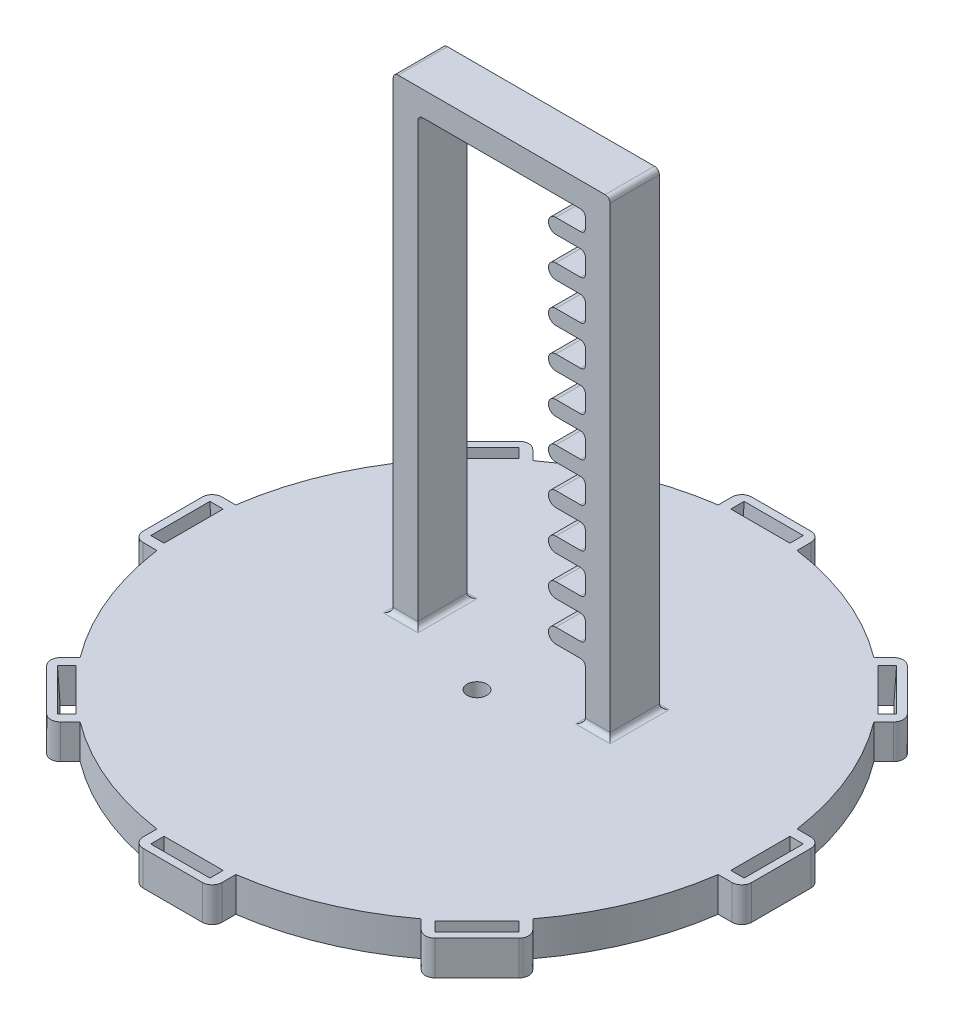
from build123d import *

# Parameters (mm, degrees)
BOSS_EXTRUDE1_DEPTH    = 7
SKETCH2_W              = 5
SKETCH2_H              = 10
BOSS_EXTRUDE2_DEPTH    = 95
SKETCH15_R             = 2
CUT_EXTRUDE3_DEPTH     = 7
CIRPATTERN1_COUNT      = 8
SKETCH18_W             = 10
SKETCH18_H             = 5
BOSS_EXTRUDE3_DEPTH    = 34
BOSS_EXTRUDE4_DEPTH    = 10
FILLET1_R              = 1
FILLET2_R              = 1
LPATTERN2_COUNT        = 10
LPATTERN2_PITCH        = 8
FILLET1_OF_LPATTERN2_R = 1


with BuildPart() as part:
    # Sketch1 → Boss-Extrude1 (new body)
    with BuildSketch(Plane(origin=(0, 0, 0), x_dir=(1, 0, 0), z_dir=(0, 1, 0))):
        with BuildLine():
            Line((-8, 56.940758688), (-8, 59.740758688))
            ThreePointArc((-8, 59.740758688), (-7.414213562, 61.154972251), (-6, 61.740758688))
            Line((-6, 61.740758688), (6, 61.740758688))
            ThreePointArc((6, 61.740758688), (7.414213562, 61.154972251), (8, 59.740758688))
            Line((8, 59.740758688), (8, 56.940758688))
            ThreePointArc((8, 56.940758688), (22.004297361, 53.123073119), (34.606342345, 45.920050844))
            Line((34.606342345, 45.920050844), (36.586241332, 47.899949831))
            ThreePointArc((36.586241332, 47.899949831), (38.000454895, 48.485736269), (39.414668457, 47.899949831))
            Line((39.414668457, 47.899949831), (47.899949831, 39.414668457))
            ThreePointArc((47.899949831, 39.414668457), (48.485736269, 38.000454895), (47.899949831, 36.586241332))
            Line((47.899949831, 36.586241332), (45.920050844, 34.606342345))
            ThreePointArc((45.920050844, 34.606342345), (53.123073119, 22.004297361), (56.940758688, 8))
            Line((56.940758688, 8), (59.740758688, 8))
            ThreePointArc((59.740758688, 8), (61.154972251, 7.414213562), (61.740758688, 6))
            Line((61.740758688, 6), (61.740758688, -6))
            ThreePointArc((61.740758688, -6), (61.154972251, -7.414213562), (59.740758688, -8))
            Line((59.740758688, -8), (56.940758688, -8))
            ThreePointArc((56.940758688, -8), (53.123073119, -22.004297361), (45.920050844, -34.606342345))
            Line((45.920050844, -34.606342345), (47.899949831, -36.586241332))
            ThreePointArc((47.899949831, -36.586241332), (48.485736269, -38.000454895), (47.899949831, -39.414668457))
            Line((47.899949831, -39.414668457), (39.414668457, -47.899949831))
            ThreePointArc((39.414668457, -47.899949831), (38.000454895, -48.485736269), (36.586241332, -47.899949831))
            Line((36.586241332, -47.899949831), (34.606342345, -45.920050844))
            ThreePointArc((34.606342345, -45.920050844), (22.004297361, -53.123073119), (8, -56.940758688))
            Line((8, -56.940758688), (8, -59.740758688))
            ThreePointArc((8, -59.740758688), (7.414213562, -61.154972251), (6, -61.740758688))
            Line((6, -61.740758688), (-6, -61.740758688))
            ThreePointArc((-6, -61.740758688), (-7.414213562, -61.154972251), (-8, -59.740758688))
            Line((-8, -59.740758688), (-8, -56.940758688))
            ThreePointArc((-8, -56.940758688), (-22.004297361, -53.123073119), (-34.606342345, -45.920050844))
            Line((-34.606342345, -45.920050844), (-36.586241332, -47.899949831))
            ThreePointArc((-36.586241332, -47.899949831), (-38.000454895, -48.485736269), (-39.414668457, -47.899949831))
            Line((-39.414668457, -47.899949831), (-47.899949831, -39.414668457))
            ThreePointArc((-47.899949831, -39.414668457), (-48.485736269, -38.000454895), (-47.899949831, -36.586241332))
            Line((-47.899949831, -36.586241332), (-45.920050844, -34.606342345))
            ThreePointArc((-45.920050844, -34.606342345), (-53.123073119, -22.004297361), (-56.940758688, -8))
            Line((-56.940758688, -8), (-59.740758688, -8))
            ThreePointArc((-59.740758688, -8), (-61.154972251, -7.414213562), (-61.740758688, -6))
            Line((-61.740758688, -6), (-61.740758688, 6))
            ThreePointArc((-61.740758688, 6), (-61.154972251, 7.414213562), (-59.740758688, 8))
            Line((-59.740758688, 8), (-56.940758688, 8))
            ThreePointArc((-56.940758688, 8), (-53.123073119, 22.004297361), (-45.920050844, 34.606342345))
            Line((-45.920050844, 34.606342345), (-47.899949831, 36.586241332))
            ThreePointArc((-47.899949831, 36.586241332), (-48.485736269, 38.000454895), (-47.899949831, 39.414668457))
            Line((-47.899949831, 39.414668457), (-39.414668457, 47.899949831))
            ThreePointArc((-39.414668457, 47.899949831), (-38.000454895, 48.485736269), (-36.586241332, 47.899949831))
            Line((-36.586241332, 47.899949831), (-34.606342345, 45.920050844))
            ThreePointArc((-34.606342345, 45.920050844), (-22.004297361, 53.123073119), (-8, 56.940758688))
        make_face()
    extrude(amount=BOSS_EXTRUDE1_DEPTH)

    # Sketch2 → Boss-Extrude2 (add)
    with BuildSketch(Plane(origin=(0, 7, 0), x_dir=(1, 0, 0), z_dir=(0, 1, 0))):
        with Locations((19.5, 10)):
            Rectangle(SKETCH2_W, SKETCH2_H)
        with Locations((-19.5, 10)):
            Rectangle(SKETCH2_W, SKETCH2_H)
    extrude(amount=BOSS_EXTRUDE2_DEPTH)

    # Sketch15 → Cut-Extrude3 (cut)
    with BuildSketch(Plane.XZ):
        with Locations(Location((0, 0, 0), (0, 0, 270))):
            Circle(SKETCH15_R)
    extrude(amount=-CUT_EXTRUDE3_DEPTH, mode=Mode.SUBTRACT)

    # Sketch16 → Cut-Loft2 section 0
    with BuildSketch(Plane.XZ):
        with BuildLine():
            Line((-6, 59.8), (6, 59.8))
            Line((6, 59.8), (6, 57.5))
            Line((6, 57.5), (-6, 57.5))
            Line((-6, 57.5), (-6, 59.8))
        make_face()
    # Sketch17 → Cut-Loft2 section 1
    with BuildSketch(Plane(origin=(0, 7, 0), x_dir=(1, 0, 0), z_dir=(0, 1, 0))):
        with BuildLine():
            Line((-6, -57.5), (6, -57.5))
            Line((6, -57.5), (6, -60.2))
            Line((6, -60.2), (-6, -60.2))
            Line((-6, -60.2), (-6, -57.5))
        make_face()
    cut_loft2 = loft(mode=Mode.SUBTRACT)

    # CirPattern1: Cut-Loft2 ×8 about axis
    cirpattern1_axis = Axis((0, 0, 0), (0, 1, 0))
    for i in range(1, CIRPATTERN1_COUNT):
        add(cut_loft2.rotate(cirpattern1_axis, i * 360 / CIRPATTERN1_COUNT), mode=Mode.SUBTRACT)

    # Sketch18 → Boss-Extrude3 (add)
    with BuildSketch(Plane(origin=(-17, 0, 0), x_dir=(0, 0, -1), z_dir=(1, 0, 0))):
        with Locations((10, 99.5)):
            Rectangle(SKETCH18_W, SKETCH18_H)
    extrude(amount=BOSS_EXTRUDE3_DEPTH)

    # Sketch19 → Boss-Extrude4 (add)
    with BuildSketch(Plane(origin=(0, 0, -15), x_dir=(-1, 0, 0), z_dir=(0, 0, -1))):
        with BuildLine():
            Line((-17, 93), (-11, 93))
            ThreePointArc((-11, 93), (-9.5, 91.5), (-11, 90))
            Line((-11, 90), (-17, 90))
            Line((-17, 90), (-17, 93))
        make_face()
    boss_extrude4 = extrude(amount=-BOSS_EXTRUDE4_DEPTH)

    # Fillet1
    fillet1_edges = [part.edges().sort_by_distance(p)[0] for p in [
        (17, 90, -10),
        (17, 93, -10),
    ]]
    fillet(fillet1_edges, radius=FILLET1_R)

    # Fillet2
    fillet2_edges = [part.edges().sort_by_distance(p)[0] for p in [
        (22, 7, -10),
        (19.5, 7, -15),
        (17, 7, -10),
        (19.5, 7, -5),
        (22, 102, -10),
        (-17, 7, -10),
        (-19.5, 7, -15),
        (-22, 7, -10),
        (-19.5, 7, -5),
        (-22, 102, -10),
        (-17, 97, -10),
        (17, 97, -10),
    ]]
    fillet(fillet2_edges, radius=FILLET2_R)

    # LPattern2: Boss-Extrude4 ×10
    with Locations(*[(0, -i * LPATTERN2_PITCH, 0) for i in range(1, LPATTERN2_COUNT)]):
        add(boss_extrude4)

    # Fillet1 of LPattern2
    fillet1_of_lpattern2_edges = [part.edges().sort_by_distance(p)[0] for p in [
        (17, 82, -10),
        (17, 85, -10),
        (17, 74, -10),
        (17, 77, -10),
        (17, 66, -10),
        (17, 69, -10),
        (17, 58, -10),
        (17, 61, -10),
        (17, 50, -10),
        (17, 53, -10),
        (17, 42, -10),
        (17, 45, -10),
        (17, 34, -10),
        (17, 37, -10),
        (17, 26, -10),
        (17, 29, -10),
        (17, 18, -10),
        (17, 21, -10),
    ]]
    fillet(fillet1_of_lpattern2_edges, radius=FILLET1_OF_LPATTERN2_R)


solid = part.part
